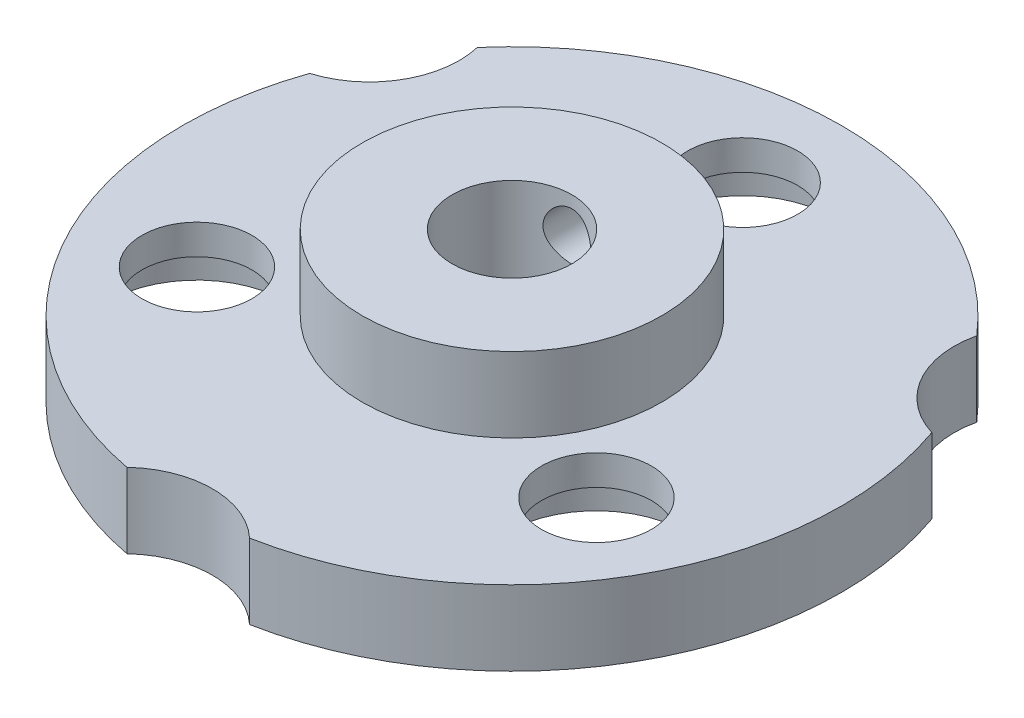
from build123d import *

# Parameters (mm, degrees)
ESBO_O1_R                                      = 11
RESSALTO_EXTRUS_O1_DEPTH                       = 2.5
ESBO_O3_R                                      = 1.835521505
CORTE_EXTRUS_O1_DEPTH                          = 2.5
ESBO_O18_R                                     = 5
RESSALTO_EXTRUS_O5_DEPTH                       = 2.5
ESBO_O20_R                                     = 2
CORTE_EXTRUS_O5_DEPTH                          = 5.5
BROCA_DE_ROSQUEAR_PARA_TARRAXA_DE_M2X0_4_REACH = 21.785
BROCA_DE_ROSQUEAR_PARA_TARRAXA_DE_M2_2_R       = 0.8
ESBO_O22_R                                     = 3
CORTE_EXTRUS_O6_DEPTH                          = 5.5
ESBO_O23_R                                     = 3
CORTE_EXTRUS_O7_DEPTH                          = 1.5


with BuildPart() as part:
    # Esboço1 → Ressalto-extrusão1 (new body)
    with BuildSketch(Plane(origin=(0, 0, 0), x_dir=(1, 0, 0), z_dir=(0, 1, 0))):
        with Locations(Location((0, 0, 0), (0, 0, 270))):
            Circle(ESBO_O1_R)
    extrude(amount=RESSALTO_EXTRUS_O1_DEPTH)

    # Esboço3 → Corte-extrusão1 (cut)
    with BuildSketch(Plane(origin=(0, 2.5, 0), x_dir=(1, 0, 0), z_dir=(0, 1, 0))):
        with Locations(Location((0, 7.7, 0), (0, 0, 270))):
            Circle(ESBO_O3_R)
        with Locations(Location((6.668395609, -3.85, 0), (0, 0, 270))):
            Circle(ESBO_O3_R)
        with Locations(Location((-6.668395609, -3.85, 0), (0, 0, 270))):
            Circle(ESBO_O3_R)
    extrude(amount=-CORTE_EXTRUS_O1_DEPTH, mode=Mode.SUBTRACT)

    # Esboço18 → Ressalto-extrusão5 (add)
    with BuildSketch(Plane(origin=(0, 2.5, 0), x_dir=(1, 0, 0), z_dir=(0, 1, 0))):
        with Locations(Location((0, 0, 0), (0, 0, 270))):
            Circle(ESBO_O18_R)
    extrude(amount=RESSALTO_EXTRUS_O5_DEPTH)

    # Esboço20 → Corte-extrusão5 (cut)
    with BuildSketch(Plane(origin=(0, 5, 0), x_dir=(1, 0, 0), z_dir=(0, 1, 0))):
        with Locations(Location((0, 0, 0), (0, 0, 270))):
            Circle(ESBO_O20_R)
    extrude(amount=-CORTE_EXTRUS_O5_DEPTH, mode=Mode.SUBTRACT)

    # Broca de rosquear para tarraxa de M2 2 (on position points) → Broca de rosquear para tarraxa de M2x0.41 (cut, up to next)
    with BuildSketch(Plane(origin=(0.002598781, 3.792959438, -4.999999325), x_dir=(-0.999999864927, 0, -0.000519756122), z_dir=(0.000519756122, 0, -0.999999864927)), mode=Mode.PRIVATE) as broca_de_rosquear_para_tarraxa_de_m2x0_4_sk1:
        Circle(BROCA_DE_ROSQUEAR_PARA_TARRAXA_DE_M2_2_R)
    broca_de_rosquear_para_tarraxa_de_m2x0_4_tool1 = extrude(broca_de_rosquear_para_tarraxa_de_m2x0_4_sk1.sketch, amount=-BROCA_DE_ROSQUEAR_PARA_TARRAXA_DE_M2X0_4_REACH, mode=Mode.PRIVATE) & part.part
    add(broca_de_rosquear_para_tarraxa_de_m2x0_4_tool1.solids().sort_by_distance((0.002599, 3.792959, -4.999999))[0], mode=Mode.SUBTRACT)

    # Esboço22 → Corte-extrusão6 (cut)
    with BuildSketch(Plane(origin=(0, 2.5, 0), x_dir=(1, 0, 0), z_dir=(0, 1, 0))):
        with Locations((-11.258330249, 6.5)):
            Circle(ESBO_O22_R)
        with Locations((0, -13)):
            Circle(ESBO_O22_R)
        with Locations((11.258330249, 6.5)):
            Circle(ESBO_O22_R)
    extrude(amount=-CORTE_EXTRUS_O6_DEPTH, mode=Mode.SUBTRACT)

    # Esboço23 → Corte-extrusão7 (cut)
    with BuildSketch(Plane(origin=(0, 0, 0), x_dir=(-1, 0, 0), z_dir=(0, -1, 0))):
        with Locations(Location((-6.668395609, -3.85, 0), (0, 0, 90))):
            Circle(ESBO_O23_R)
        with Locations(Location((6.668395609, -3.85, 0), (0, 0, 90))):
            Circle(ESBO_O23_R)
        with Locations(Location((0, 7.7, 0), (0, 0, 90))):
            Circle(ESBO_O23_R)
    extrude(amount=-CORTE_EXTRUS_O7_DEPTH, mode=Mode.SUBTRACT)


solid = part.part
